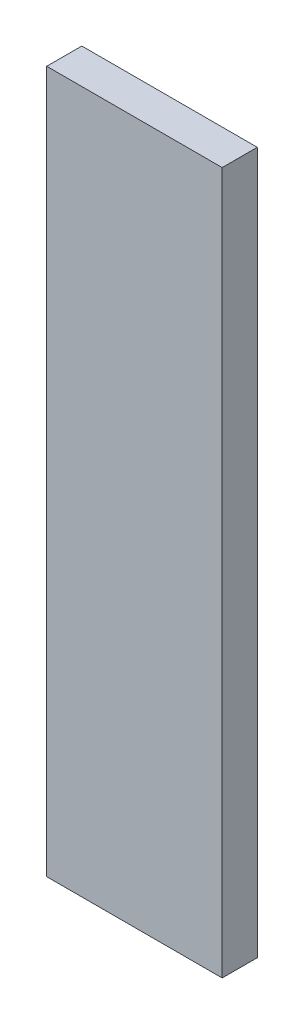
from build123d import *

# Parameters (mm, degrees)
ESBO_O1_W                = 30
ESBO_O1_H                = 120
RESSALTO_EXTRUS_O1_DEPTH = 6


with BuildPart() as part:
    # Esboço1 → Ressalto-extrusão1 (new body)
    with BuildSketch(Plane.XY):
        with Locations((15, 60)):
            Rectangle(ESBO_O1_W, ESBO_O1_H)
    extrude(amount=RESSALTO_EXTRUS_O1_DEPTH)


solid = part.part
